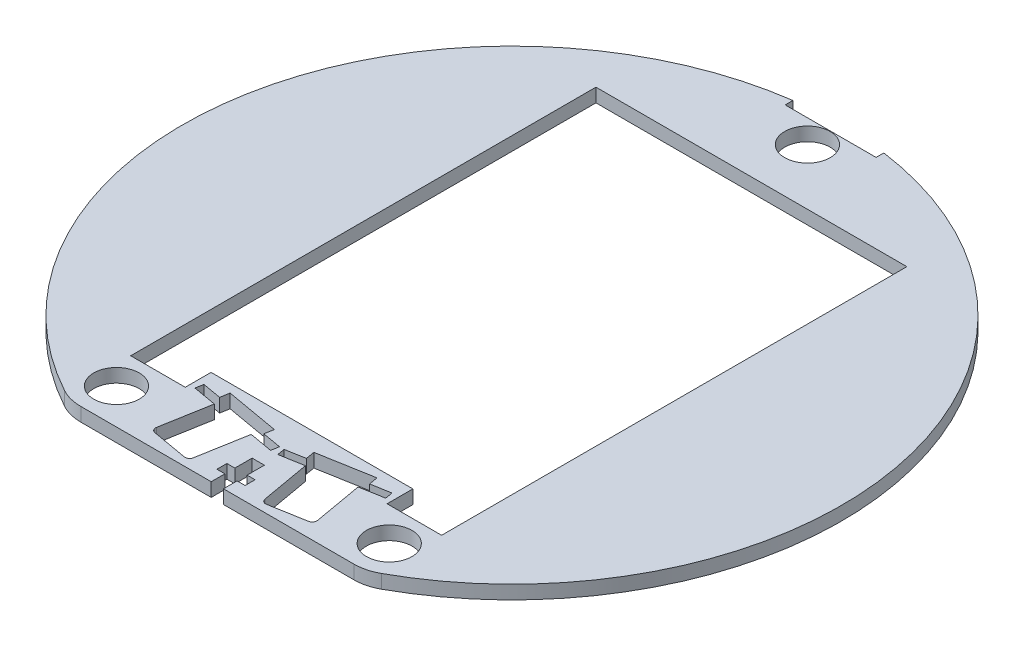
from build123d import *

# Parameters (mm, degrees)
BOSS_EXTRUDE1_DEPTH = 3
CUT_EXTRUDE1_DEPTH  = 103.574363269
CUT_EXTRUDE3_DEPTH  = 103.574363269
CUT_EXTRUDE4_DEPTH  = 103.574363269
SKETCH6_W           = 68.4
SKETCH6_H           = 3
CUT_EXTRUDE5_DEPTH  = 103.574363269
SKETCH7_R           = 5
CUT_EXTRUDE6_DEPTH  = 103.574363269
SKETCH11_R          = 5
CUT_EXTRUDE10_DEPTH = 103.574363269
SKETCH15_W          = 20
SKETCH15_H          = 1.7
CUT_EXTRUDE14_DEPTH = 103.574363269
CUT_EXTRUDE15_DEPTH = 103.085748271


with BuildPart() as part:
    # Sketch1 → Boss-Extrude1 (new body)
    with BuildSketch(Plane(origin=(0, 0, 0), x_dir=(1, 0, 0), z_dir=(0, 1, 0))):
        with BuildLine():
            Line((-30.029977361, -64.812867647), (30.029977361, -64.812867647))
            ThreePointArc((30.029977361, -64.812867647), (32.509837414, -64.500503794), (34.834773739, -63.582926471))
            ThreePointArc((34.834773739, -63.582926471), (0, 72.5), (-34.834773739, -63.582926471))
            ThreePointArc((-34.834773739, -63.582926471), (-32.509837414, -64.500503794), (-30.029977361, -64.812867647))
        make_face()
    extrude(amount=BOSS_EXTRUDE1_DEPTH)

    # Sketch2 → Cut-Extrude1 (cut, through all)
    with BuildSketch(Plane(origin=(0, 3, 0), x_dir=(1, 0, 0), z_dir=(0, 1, 0))):
        Polygon((-34.2, -49.675685802), (-22.2, -49.675685802), (-22.2, -44), (22.2, -44), (22.2, -49.675685802), (34.2, -49.675685802), (34.2, 49.675685802), (22.2, 49.675685802), (22.2, 44), (-22.2, 44), (-22.2, 49.675685802), (-34.2, 49.675685802), align=None)
    extrude(amount=-CUT_EXTRUDE1_DEPTH, mode=Mode.SUBTRACT)

    # Sketch4 → Cut-Extrude3 (cut, through all)
    with BuildSketch(Plane(origin=(0, 3, 0), x_dir=(1, 0, 0), z_dir=(0, 1, 0))):
        Polygon((-20.983760839, -48.753080005), (-0.795201902, -52.312867647), (-0.5, -50.638694467), (-20.688558937, -47.078906825), align=None)
        Polygon((20.983760839, -48.753080005), (20.688558937, -47.078906825), (0.5, -50.638694467), (0.795201902, -52.312867647), align=None)
    extrude(amount=-CUT_EXTRUDE3_DEPTH, mode=Mode.SUBTRACT)

    # Sketch5 → Cut-Extrude4 (cut, through all)
    with BuildSketch(Plane(origin=(0, 3, 0), x_dir=(1, 0, 0), z_dir=(0, 1, 0))):
        with BuildLine():
            Line((5.965442605, -51.401214714), (15.813520135, -49.664732938))
            Line((15.813520135, -49.664732938), (17.72365009, -60.497618221))
            ThreePointArc((17.72365009, -60.497618221), (17.557994381, -61.244842835), (16.912490514, -61.656074151))
            Line((16.912490514, -61.656074151), (9.03402849, -63.045259573))
            ThreePointArc((9.03402849, -63.045259573), (8.286803876, -62.879603864), (7.87557256, -62.234099997))
            Line((7.87557256, -62.234099997), (5.965442605, -51.401214714))
        make_face()
        Polygon((16.503125986, -47.81691158), (4.68543295, -49.900689712), (4.338136595, -47.931074206), (16.155829631, -45.847296074), align=None)
        Polygon((-16.155829631, -45.847296074), (-4.338136595, -47.931074206), (-4.68543295, -49.900689712), (-16.503125986, -47.81691158), align=None)
        with BuildLine():
            Line((-9.03402849, -63.045259573), (-16.912490514, -61.656074151))
            ThreePointArc((-16.912490514, -61.656074151), (-17.557994381, -61.244842835), (-17.72365009, -60.497618221))
            Line((-17.72365009, -60.497618221), (-15.813520135, -49.664732938))
            Line((-15.813520135, -49.664732938), (-5.965442605, -51.401214714))
            Line((-5.965442605, -51.401214714), (-7.87557256, -62.234099997))
            ThreePointArc((-7.87557256, -62.234099997), (-8.286803876, -62.879603864), (-9.03402849, -63.045259573))
        make_face()
    extrude(amount=-CUT_EXTRUDE4_DEPTH, mode=Mode.SUBTRACT)

    # Sketch6 → Cut-Extrude5 (cut, through all)
    with BuildSketch(Plane(origin=(0, 3, 0), x_dir=(1, 0, 0), z_dir=(0, 1, 0))):
        with Locations((0, 51.175685802)):
            Rectangle(SKETCH6_W, SKETCH6_H)
    extrude(amount=-CUT_EXTRUDE5_DEPTH, mode=Mode.SUBTRACT)


with BuildPart() as cut_extrude5_kept_piece:
    # of the separate pieces the step leaves, the one the design keeps (cut_extrude5_pieces_kept)
    add(part.part.solids().sort_by_distance((-34.834773739, 0, 63.582926471))[0])

    # Sketch7 → Cut-Extrude6 (cut, through all)
    with BuildSketch(Plane(origin=(0, 3, 0), x_dir=(1, 0, 0), z_dir=(0, 1, 0))):
        with Locations(Location((-30, -57, 0), (0, 0, 90))):
            Circle(SKETCH7_R)
        with Locations(Location((30, -57, 0), (0, 0, 270))):
            Circle(SKETCH7_R)
    extrude(amount=-CUT_EXTRUDE6_DEPTH, mode=Mode.SUBTRACT)

    # Sketch11 → Cut-Extrude10 (cut, through all)
    with BuildSketch(Plane(origin=(0, 3, 0), x_dir=(1, 0, 0), z_dir=(0, 1, 0))):
        with Locations(Location((0, 65, 0), (0, 0, 270))):
            Circle(SKETCH11_R)
    extrude(amount=-CUT_EXTRUDE10_DEPTH, mode=Mode.SUBTRACT)

    # Sketch15 → Cut-Extrude14 (cut, through all)
    with BuildSketch(Plane(origin=(0, 3, 0), x_dir=(1, 0, 0), z_dir=(0, 1, 0))):
        with Locations((0, 70.957033082)):
            Rectangle(SKETCH15_W, SKETCH15_H)
    extrude(amount=-CUT_EXTRUDE14_DEPTH, mode=Mode.SUBTRACT)


with BuildPart() as body_2:
    # of the pieces the cut leaves, the one that is kept (cut_extrude14_keep)
    add(cut_extrude5_kept_piece.part.solids().sort_by_distance((-34.834773739, 0, 63.582926471))[0])

    # Sketch16 → Cut-Extrude15 (cut, through all)
    with BuildSketch(Plane(origin=(0, 3, 0), x_dir=(1, 0, 0), z_dir=(0, 1, 0))):
        Polygon((-1.35, -64.812867647), (1.35, -64.812867647), (1.35, -61.812867647), (3.1, -61.812867647), (3.1, -59.612867647), (1.35, -59.612867647), (1.35, -55.812867647), (-1.35, -55.812867647), (-1.35, -59.612867647), (-3.1, -59.612867647), (-3.1, -61.812867647), (-1.35, -61.812867647), align=None)
    extrude(amount=-CUT_EXTRUDE15_DEPTH, mode=Mode.SUBTRACT)


solid = body_2.part
